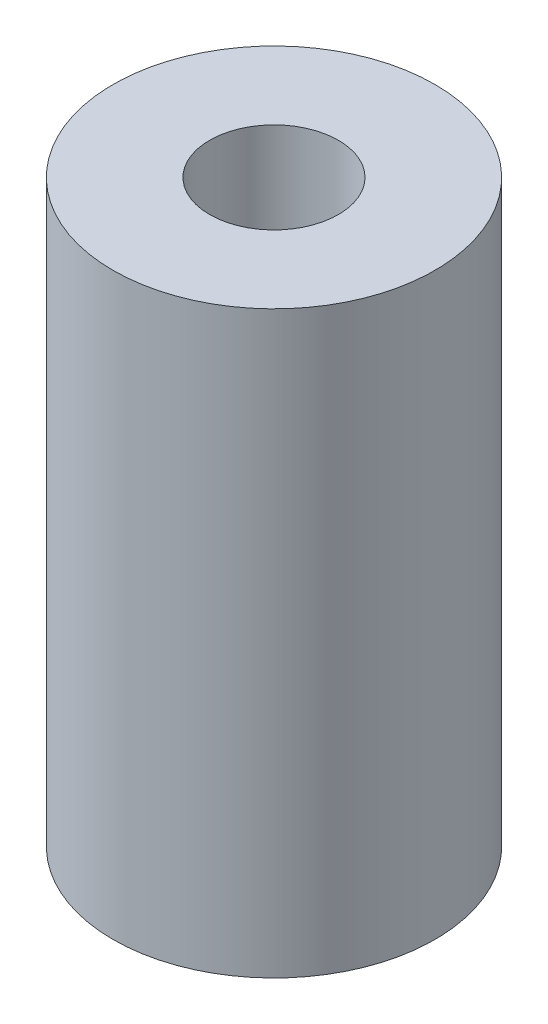
from build123d import *

# Parameters (mm, degrees)
SKETCH1_R           = 2.5
SKETCH1_R_2         = 1
BOSS_EXTRUDE1_DEPTH = 9


with BuildPart() as part:
    # Sketch1 → Boss-Extrude1 (new body)
    with BuildSketch(Plane(origin=(0, 0, 0), x_dir=(1, 0, 0), z_dir=(0, 1, 0))):
        with Locations(Location((0, 0, 0), (0, 0, 270))):
            Circle(SKETCH1_R)
        with Locations(Location((0, 0, 0), (0, 0, 270))):
            Circle(SKETCH1_R_2, mode=Mode.SUBTRACT)
    extrude(amount=BOSS_EXTRUDE1_DEPTH)


solid = part.part
